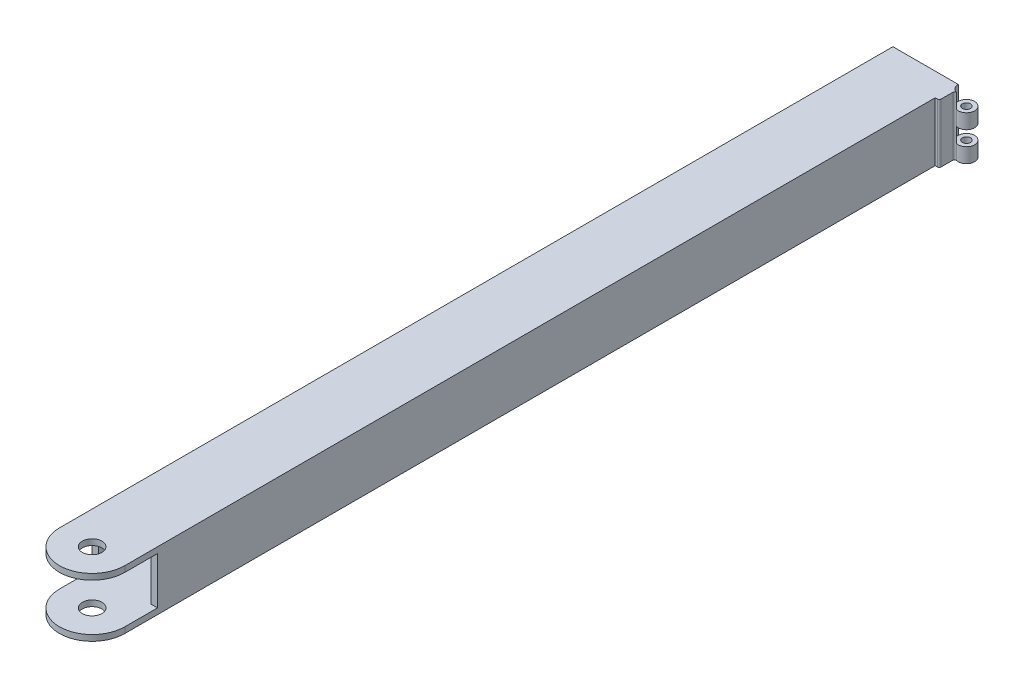
from build123d import *

# Parameters (mm, degrees)
SKETCH1_W               = 40
SKETCH1_H               = 36
SKETCH1_W_2             = 32
SKETCH1_H_2             = 28.8
BOSS_EXTRUDE1_DEPTH     = 530
SKETCH2_W               = 50
SKETCH2_H               = 28.8
CUT_EXTRUDE1_DEPTH      = 40
FILLET2_RADIUS          = 20
FILLET2_LENGTH          = 3.6
FILLET3_RADIUS          = 20
FILLET3_LENGTH          = 3.6
CUT_EXTRUDE2_DEPTH      = 532.597592169
CUT_EXTRUDE2_DEPTH_BACK = 532.597592169
SKETCH3_R               = 6
CUT_EXTRUDE3_DEPTH      = 10
SKETCH9_R               = 2.5
BOSS_EXTRUDE2_DEPTH     = 36
FILLET4_R               = 1
FILLET5_R               = 1
CUT_EXTRUDE5_START      = -9
SKETCH12_R              = 5
CUT_EXTRUDE5_DEPTH      = 9
SKETCH14_R              = 5
CUT_EXTRUDE6_DEPTH      = 9


with BuildPart() as part:
    # Sketch1 → Boss-Extrude1 (new body)
    with BuildSketch(Plane.XY):
        Rectangle(SKETCH1_W, SKETCH1_H)
        Rectangle(SKETCH1_W_2, SKETCH1_H_2, mode=Mode.SUBTRACT)
    extrude(amount=BOSS_EXTRUDE1_DEPTH)

    # Sketch2 → Cut-Extrude1 (cut)
    with BuildSketch(Plane.XY.offset(530)):
        Rectangle(SKETCH2_W, SKETCH2_H)
    extrude(amount=-CUT_EXTRUDE1_DEPTH, mode=Mode.SUBTRACT)

    # Fillet2: full round fillet: the end face becomes a half cylinder, R = half its width
    fillet2_face = Plane((0, -16.2, 530), x_dir=(0, -1, 0), z_dir=(0, 0, 1))  # on the end face: x along it, z out of the body
    fillet2_slab = fillet2_face.offset(-FILLET2_RADIUS / 2) * Box(FILLET2_LENGTH, 2 * FILLET2_RADIUS, FILLET2_RADIUS, mode=Mode.PRIVATE)  # the body's end, R deep
    fillet2_round = Plane((0, -16.2, 510), x_dir=(0, 0, 1), z_dir=(0, -1, 0)) * Cylinder(FILLET2_RADIUS, FILLET2_LENGTH, mode=Mode.PRIVATE)  # its axis R under the face
    add(fillet2_slab - fillet2_round, mode=Mode.SUBTRACT)

    # Fillet3: full round fillet: the end face becomes a half cylinder, R = half its width
    fillet3_face = Plane((0, 16.2, 530), x_dir=(0, -1, 0), z_dir=(0, 0, 1))  # on the end face: x along it, z out of the body
    fillet3_slab = fillet3_face.offset(-FILLET3_RADIUS / 2) * Box(FILLET3_LENGTH, 2 * FILLET3_RADIUS, FILLET3_RADIUS, mode=Mode.PRIVATE)  # the body's end, R deep
    fillet3_round = Plane((0, 16.2, 510), x_dir=(0, 0, 1), z_dir=(0, -1, 0)) * Cylinder(FILLET3_RADIUS, FILLET3_LENGTH, mode=Mode.PRIVATE)  # its axis R under the face
    add(fillet3_slab - fillet3_round, mode=Mode.SUBTRACT)

    # Sketch3 → Cut-Extrude2 (cut, two sides: drawn at the far end of the back side and taken through both)
    with BuildSketch(Plane(origin=(0, 18, 0), x_dir=(1, 0, 0), z_dir=(0, 1, 0)).offset(-CUT_EXTRUDE2_DEPTH_BACK)):
        with Locations(Location((0, -510, 0), (0, 0, 270))):
            Circle(SKETCH3_R)
    extrude(amount=CUT_EXTRUDE2_DEPTH + CUT_EXTRUDE2_DEPTH_BACK, mode=Mode.SUBTRACT)

    # Sketch6 → Cut-Extrude3 (cut)
    with BuildSketch(Plane.XZ.offset(18)):
        with BuildLine():
            ThreePointArc((6, 460), (0, 466), (-6, 460))
            Line((-6, 460), (-6, 360))
            ThreePointArc((-6, 360), (0, 354), (6, 360))
            Line((6, 360), (6, 460))
        make_face()
    extrude(amount=-CUT_EXTRUDE3_DEPTH, mode=Mode.SUBTRACT)

    # Sketch9 → Boss-Extrude2 (add)
    with BuildSketch(Plane.XZ.offset(18)):
        with BuildLine():
            Line((20, 14.120693524), (20, 0))
            ThreePointArc((20, 0), (29.330127019, -2.5), (22.5, 4.330127019))
            Line((22.5, 4.330127019), (22.5, 14.120693524))
            Line((22.5, 14.120693524), (20, 14.120693524))
        make_face()
        with Locations(Location((25, 0, 0), (0, 0, 270))):
            Circle(SKETCH9_R, mode=Mode.SUBTRACT)
    extrude(amount=-BOSS_EXTRUDE2_DEPTH)

    # Fillet4
    fillet4_edges = [part.edges().sort_by_distance(p)[0] for p in [
        (22.5, 0, 4.330127019),
    ]]
    fillet(fillet4_edges, radius=FILLET4_R)

    # Fillet5
    fillet5_edges = [part.edges().sort_by_distance(p)[0] for p in [
        (22.5, 0, 14.120693524),
    ]]
    fillet(fillet5_edges, radius=FILLET5_R)

    # Sketch12 → Cut-Extrude5 (cut)
    with BuildSketch(Plane(origin=(0, 18, 0), x_dir=(1, 0, 0), z_dir=(0, 1, 0)).offset(CUT_EXTRUDE5_START)):
        with Locations((25, 0)):
            Circle(SKETCH12_R)
    extrude(amount=CUT_EXTRUDE5_DEPTH, mode=Mode.SUBTRACT)

    # Sketch14 → Cut-Extrude6 (cut)
    with BuildSketch(Plane(origin=(0, -9, 0), x_dir=(-1, 0, 0), z_dir=(0, -1, 0))):
        with Locations((-25, 0)):
            Circle(SKETCH14_R)
    extrude(amount=-CUT_EXTRUDE6_DEPTH, mode=Mode.SUBTRACT)


solid = part.part
